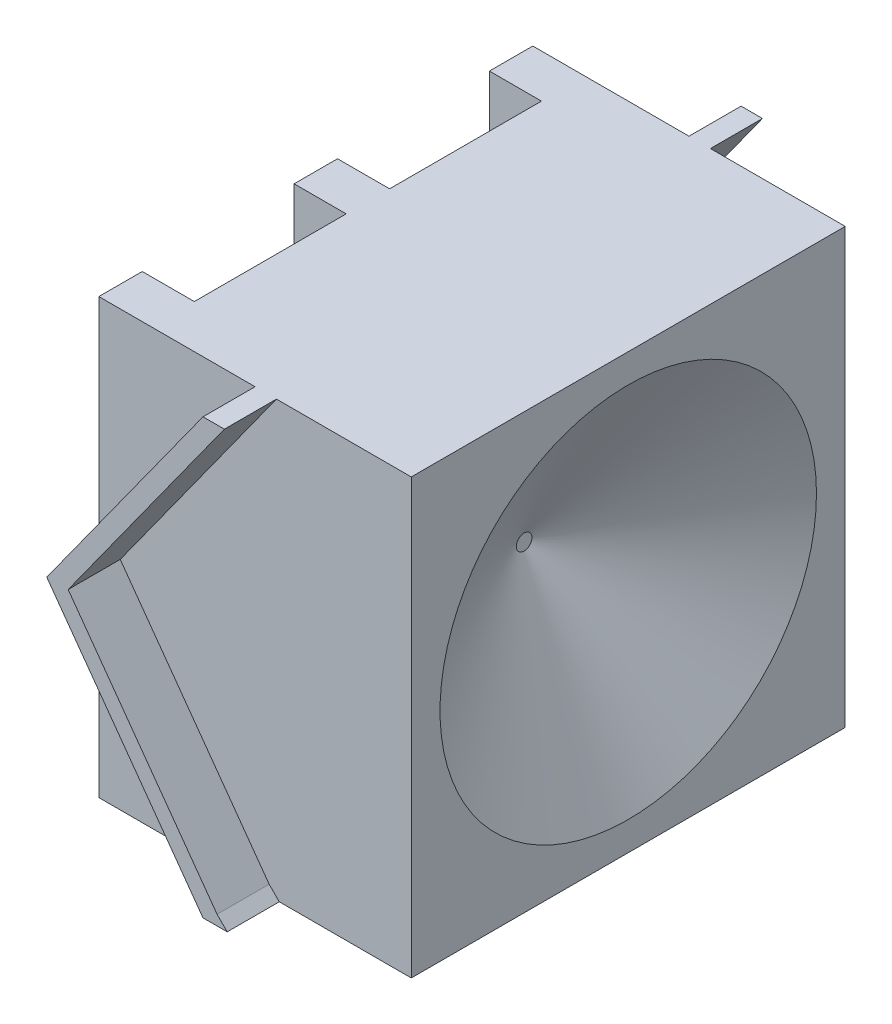
from build123d import *

# Parameters (mm, degrees)
IZIM1_W                          = 250
IZIM1_H                          = 250
Y_KSEKLIK_EKSTR_ZYON1_DEPTH      = 150
IZIM2_R                          = 108.43509044
KES_EKSTR_ZYON1_DEPTH            = 60
KES_EKSTR_ZYON1_TAPER            = 60
IZIM3_W                          = 25
IZIM3_H                          = 250
Y_KSEKLIK_EKSTR_ZYON2_DEPTH      = 30
Y_KSEKLIK_EKSTR_ZYON3_DEPTH      = 30
Y_KSEKLIK_EKSTR_ZYON3_DEPTH_BACK = 280


with BuildPart() as part:
    # Çizim1 → Yükseklik-Ekstrüzyon1 (new body)
    with BuildSketch(Plane(origin=(0, 0, 0), x_dir=(0, 0, -1), z_dir=(1, 0, 0))):
        Rectangle(IZIM1_W, IZIM1_H)
    extrude(amount=Y_KSEKLIK_EKSTR_ZYON1_DEPTH)

    # Çizim2 → Kes-Ekstrüzyon1 (cut)
    with BuildSketch(Plane(origin=(150, 0, 0), x_dir=(0, 0, -1), z_dir=(1, 0, 0))):
        Circle(IZIM2_R)
    extrude(amount=-KES_EKSTR_ZYON1_DEPTH, taper=KES_EKSTR_ZYON1_TAPER, mode=Mode.SUBTRACT)

    # Çizim3 → Yükseklik-Ekstrüzyon2 (add)
    with BuildSketch(Plane.ZY):
        with Locations((-112.5, 0)):
            Rectangle(IZIM3_W, IZIM3_H)
        with Locations((112.5, 0)):
            Rectangle(IZIM3_W, IZIM3_H)
        Rectangle(IZIM3_W, IZIM3_H)
    extrude(amount=Y_KSEKLIK_EKSTR_ZYON2_DEPTH)

    # Çizim4 → Yükseklik-Ekstrüzyon3 (add, two sides: drawn at the far end of the back side and taken through both)
    with BuildSketch(Plane.XY.offset(125).offset(-Y_KSEKLIK_EKSTR_ZYON3_DEPTH_BACK)):
        Polygon((60, 125), (-30, 0), (60, -125), (73.958390673, -125), (68.115343415, -119.156952742), (-17.677662559, 0), (68.115343415, 119.156952742), (72.322337441, 125), align=None)
    extrude(amount=Y_KSEKLIK_EKSTR_ZYON3_DEPTH + Y_KSEKLIK_EKSTR_ZYON3_DEPTH_BACK)


solid = part.part
